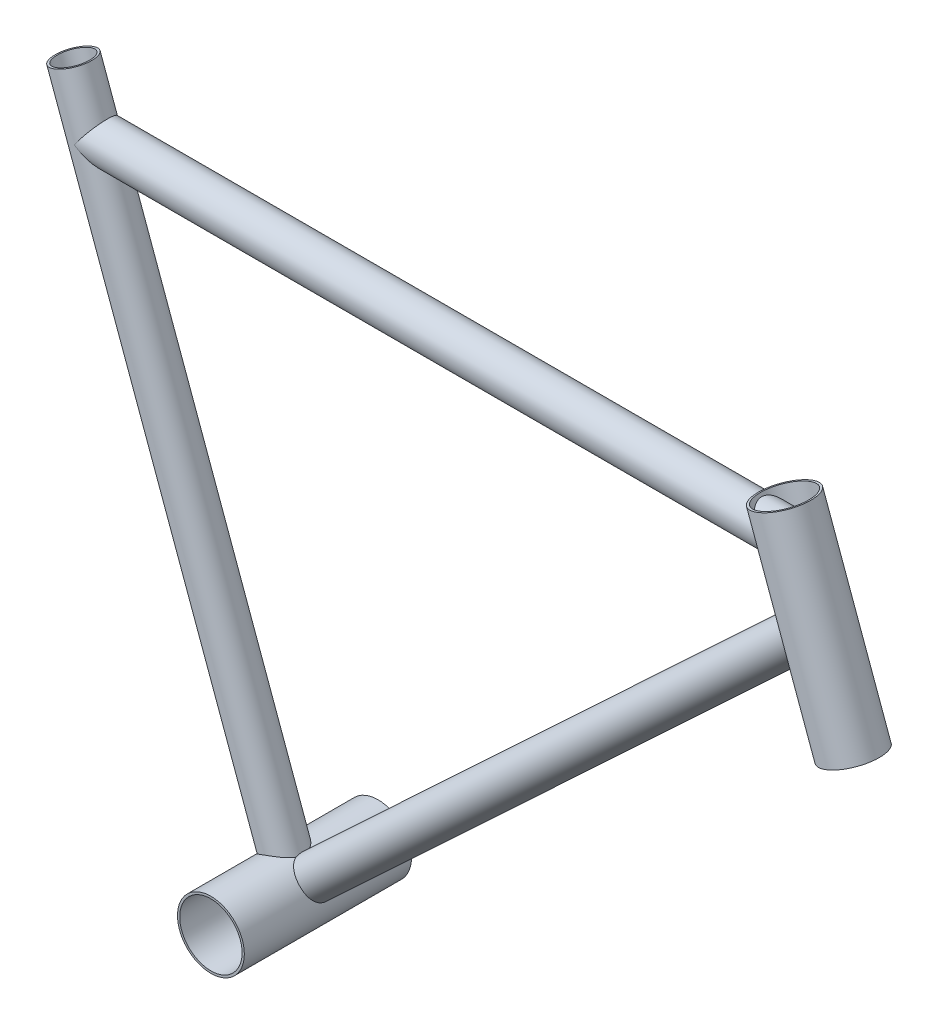
from build123d import *
from build123d.topology import SkipClean

# Parameters (mm, degrees)
CROQUIS1_R                               = 30
CROQUIS1_R_2                             = 28
SALIENTE_EXTRUIR1_DEPTH                  = 150
CROQUIS3_R                               = 17.5
CROQUIS3_R_2                             = 15.5
SALIENTE_EXTRUIR2_DEPTH                  = 550
SALIENTE_EXTRUIR2_DIRECTION_2_REACH      = 167.853
SALIENTE_EXTRUIR2_DIRECTION_2_END_RADIUS = 30
CROQUIS4_R                               = 17.5
CROQUIS4_R_2                             = 15.5
SALIENTE_EXTRUIR3_DEPTH                  = 450
SALIENTE_EXTRUIR3_DIRECTION_2_REACH      = 612.127
SALIENTE_EXTRUIR3_DIRECTION_2_END_RADIUS = 17.5
SALIENTE_EXTRUIR5_DEPTH                  = 150
SALIENTE_EXTRUIR5_DEPTH_BACK             = 30
CROQUIS6_R                               = 25
CROQUIS6_R_2                             = 23
SALIENTE_EXTRUIR6_REACH                  = 748.218
SALIENTE_EXTRUIR6_END_RADIUS             = 25
CROQUIS8_R                               = 17.5
CROQUIS8_R_2                             = 15.5
SALIENTE_EXTRUIR6_DIRECTION_2_REACH      = 748.218
SALIENTE_EXTRUIR6_DIRECTION_2_END_RADIUS = 30


with BuildPart() as part:
    # Croquis1 → Saliente-Extruir1 (new body)
    with BuildSketch(Plane.XY):
        Circle(CROQUIS1_R)
        Circle(CROQUIS1_R_2, mode=Mode.SUBTRACT)
    extrude(amount=SALIENTE_EXTRUIR1_DEPTH)



with BuildPart() as body_2:
    # Croquis3 → Saliente-Extruir2 (new body)
    with BuildSketch(Plane(origin=(-10.2606043, 28.190778624, 0), x_dir=(0.9396926207859082, 0.3420201433256694, 0), z_dir=(-0.3420201433256694, 0.9396926207859083, 0))):
        with Locations((0, -75)):
            Circle(CROQUIS3_R)
        with Locations((0, -75)):
            Circle(CROQUIS3_R_2, mode=Mode.SUBTRACT)
    extrude(amount=SALIENTE_EXTRUIR2_DEPTH)

    # Saliente-Extruir2 direction 2: up to this cylinder (the profile starts outside it)
    with SkipClean():  # the faces are left unmerged after this step: merging them gives an invalid solid
        saliente_extruir2_direction_2_end = Plane(origin=(0, 0, 75), z_dir=(0, 0, -1)) * Cylinder(SALIENTE_EXTRUIR2_DIRECTION_2_END_RADIUS, 396.706, mode=Mode.PRIVATE)
        # Croquis3 → Saliente-Extruir2 direction 2 (add, up to the surface)
        with BuildSketch(Plane(origin=(-10.2606043, 28.190778624, 0), x_dir=(0.9396926207859082, 0.3420201433256694, 0), z_dir=(-0.3420201433256694, 0.9396926207859083, 0)), mode=Mode.PRIVATE) as saliente_extruir2_direction_2_sk1:
            with Locations((0, -75)):
                Circle(CROQUIS3_R)
            with Locations((0, -75)):
                Circle(CROQUIS3_R_2, mode=Mode.SUBTRACT)
        saliente_extruir2_direction_2_tool1 = extrude(saliente_extruir2_direction_2_sk1.sketch, amount=-SALIENTE_EXTRUIR2_DIRECTION_2_REACH, mode=Mode.PRIVATE) - saliente_extruir2_direction_2_end
        add(saliente_extruir2_direction_2_tool1.solids().sort_by_distance((-26.240101, 22.374717, 75))[0])
        add(saliente_extruir2_direction_2_tool1.solids().sort_by_distance((-26.240101, 22.374717, 75))[1])

    # Croquis4 → Saliente-Extruir3 (add)
    with SkipClean():  # the faces are left unmerged after this step: merging them gives an invalid solid
        with BuildSketch(Plane(origin=(0, 0, 0), x_dir=(0, 0, -1), z_dir=(1, 0, 0))):
            with Locations((-75, 495.021720056)):
                Circle(CROQUIS4_R)
            with Locations((-75, 495.021720056)):
                Circle(CROQUIS4_R_2, mode=Mode.SUBTRACT)
        extrude(amount=SALIENTE_EXTRUIR3_DEPTH)

    # Saliente-Extruir3 direction 2: up to this cylinder (the profile starts outside it)
    with SkipClean():  # the faces are left unmerged after this step: merging them gives an invalid solid
        saliente_extruir3_direction_2_end = Plane(origin=(-159.096914071, 437.115178915, 75), z_dir=(0.3420201433256694, -0.9396926207859082, 0)) * Cylinder(SALIENTE_EXTRUIR3_DIRECTION_2_END_RADIUS, 1260.254, mode=Mode.PRIVATE)
        # Croquis4 → Saliente-Extruir3 direction 2 (add, up to the surface)
        with BuildSketch(Plane(origin=(0, 0, 0), x_dir=(0, 0, -1), z_dir=(1, 0, 0)), mode=Mode.PRIVATE) as saliente_extruir3_direction_2_sk1:
            with Locations((-75, 495.021720056)):
                Circle(CROQUIS4_R)
            with Locations((-75, 495.021720056)):
                Circle(CROQUIS4_R_2, mode=Mode.SUBTRACT)
        saliente_extruir3_direction_2_tool1 = extrude(saliente_extruir3_direction_2_sk1.sketch, amount=-SALIENTE_EXTRUIR3_DIRECTION_2_REACH, mode=Mode.PRIVATE) - saliente_extruir3_direction_2_end
        add(saliente_extruir3_direction_2_tool1.solids().sort_by_distance((0, 495.02172, 92.005025))[0])

    # Croquis6 → Saliente-Extruir5 (add, two sides: drawn at the far end of the back side and taken through both)
    with BuildSketch(Plane(origin=(450, 495.021720056, 0), x_dir=(-0.9396926207859105, -0.342020143325663, 0), z_dir=(0.342020143325663, -0.9396926207859105, 0)).offset(-SALIENTE_EXTRUIR5_DEPTH_BACK)):
        with Locations((0, -75)):
            Circle(CROQUIS6_R)
        with Locations((0, -75)):
            Circle(CROQUIS6_R_2, mode=Mode.SUBTRACT)
    extrude(amount=SALIENTE_EXTRUIR5_DEPTH + SALIENTE_EXTRUIR5_DEPTH_BACK)


with BuildPart() as part_1:
    add(part.part)

    add(body_2.part)  # Saliente-Extruir6 merges body 2
    # Saliente-Extruir6: up to this cylinder (the profile starts outside it)
    saliente_extruir6_end = Plane(origin=(552.440580705, 213.568537732, 75), z_dir=(0.342020143325663, -0.9396926207859105, 0)) * Cylinder(SALIENTE_EXTRUIR6_END_RADIUS, 1547.436, mode=Mode.PRIVATE)
    # Croquis8 → Saliente-Extruir6 (add, up to the surface)
    with BuildSketch(Plane(origin=(21.92501468, 20.476663089, 0), x_dir=(0, 0, -1), z_dir=(0.7308338226719873, 0.6825554363116965, 0)), mode=Mode.PRIVATE) as saliente_extruir6_sk1:
        with Locations((-75, 0)):
            Circle(CROQUIS8_R)
        with Locations((-75, 0)):
            Circle(CROQUIS8_R_2, mode=Mode.SUBTRACT)
    saliente_extruir6_tool1 = extrude(saliente_extruir6_sk1.sketch, amount=SALIENTE_EXTRUIR6_REACH, mode=Mode.PRIVATE) - saliente_extruir6_end
    add(saliente_extruir6_tool1.solids().sort_by_distance((21.925015, 20.476663, 92.005025))[0])

    # Saliente-Extruir6 direction 2: up to this cylinder (the profile starts outside it)
    saliente_extruir6_direction_2_end = Plane(origin=(0, 0, 92.005025), z_dir=(0, 0, -1)) * Cylinder(SALIENTE_EXTRUIR6_DIRECTION_2_END_RADIUS, 1557.436, mode=Mode.PRIVATE)
    # Croquis8 → Saliente-Extruir6 direction 2 (add, up to the surface)
    with BuildSketch(Plane(origin=(21.92501468, 20.476663089, 0), x_dir=(0, 0, -1), z_dir=(0.7308338226719873, 0.6825554363116965, 0)), mode=Mode.PRIVATE) as saliente_extruir6_direction_2_sk1:
        with Locations((-75, 0)):
            Circle(CROQUIS8_R)
        with Locations((-75, 0)):
            Circle(CROQUIS8_R_2, mode=Mode.SUBTRACT)
    saliente_extruir6_direction_2_tool1 = extrude(saliente_extruir6_direction_2_sk1.sketch, amount=-SALIENTE_EXTRUIR6_DIRECTION_2_REACH, mode=Mode.PRIVATE) - saliente_extruir6_direction_2_end
    add(saliente_extruir6_direction_2_tool1.solids().sort_by_distance((21.925015, 20.476663, 92.005025))[0])
    add(saliente_extruir6_direction_2_tool1.solids().sort_by_distance((21.925015, 20.476663, 92.005025))[1])


solid = part_1.part
